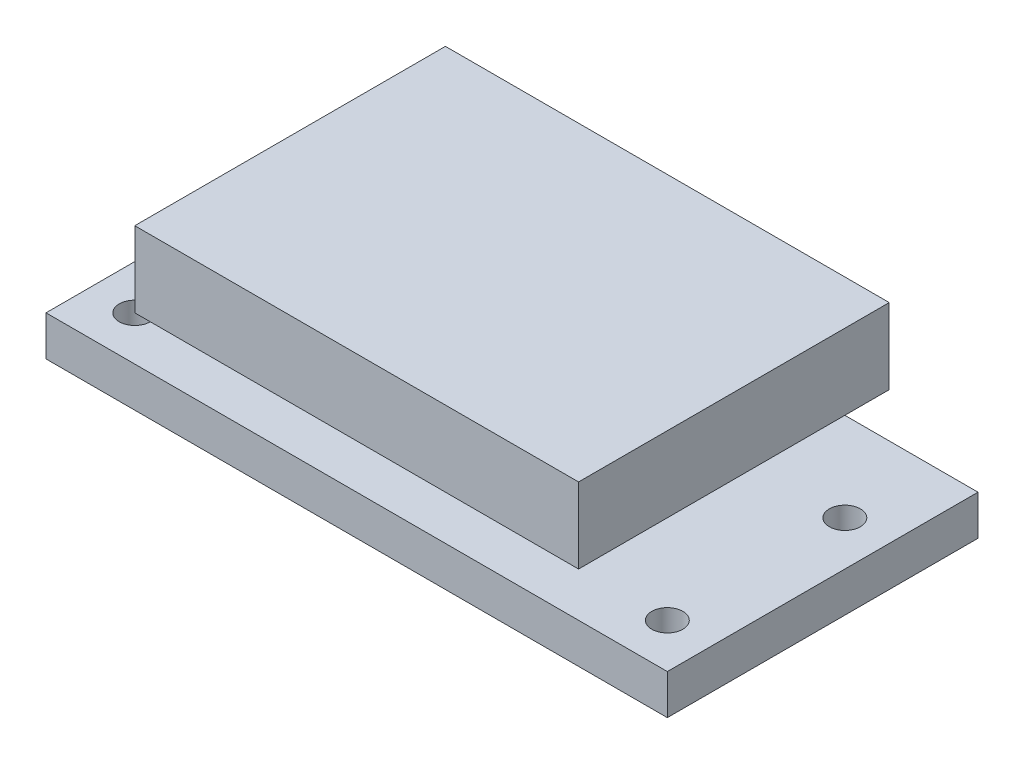
from build123d import *

# Parameters (mm, degrees)
SKETCH1_W           = 70
SKETCH1_H           = 35
SKETCH1_R           = 1.75
BOSS_EXTRUDE1_DEPTH = 4.5
SKETCH2_W           = 50
SKETCH2_H           = 35
BOSS_EXTRUDE2_DEPTH = 8.5


with BuildPart() as part:
    # Sketch1 → Boss-Extrude1 (new body)
    with BuildSketch(Plane(origin=(0, 0, 0), x_dir=(1, 0, 0), z_dir=(0, 1, 0))):
        Rectangle(SKETCH1_W, SKETCH1_H)
        with Locations(Location((-30, 7.5, 0), (0, 0, 270))):
            Circle(SKETCH1_R, mode=Mode.SUBTRACT)
        with Locations(Location((30, 7.5, 0), (0, 0, 270))):
            Circle(SKETCH1_R, mode=Mode.SUBTRACT)
        with Locations(Location((30, -12.5, 0), (0, 0, 270))):
            Circle(SKETCH1_R, mode=Mode.SUBTRACT)
        with Locations(Location((-30, -12.5, 0), (0, 0, 270))):
            Circle(SKETCH1_R, mode=Mode.SUBTRACT)
    extrude(amount=BOSS_EXTRUDE1_DEPTH)


with BuildPart() as body_2:
    # Sketch2 → Boss-Extrude2 (new body)
    with BuildSketch(Plane(origin=(0, 9.5, 0), x_dir=(1, 0, 0), z_dir=(0, 1, 0))):
        Rectangle(SKETCH2_W, SKETCH2_H)
    extrude(amount=BOSS_EXTRUDE2_DEPTH)


solid = Compound([part.part, body_2.part])
